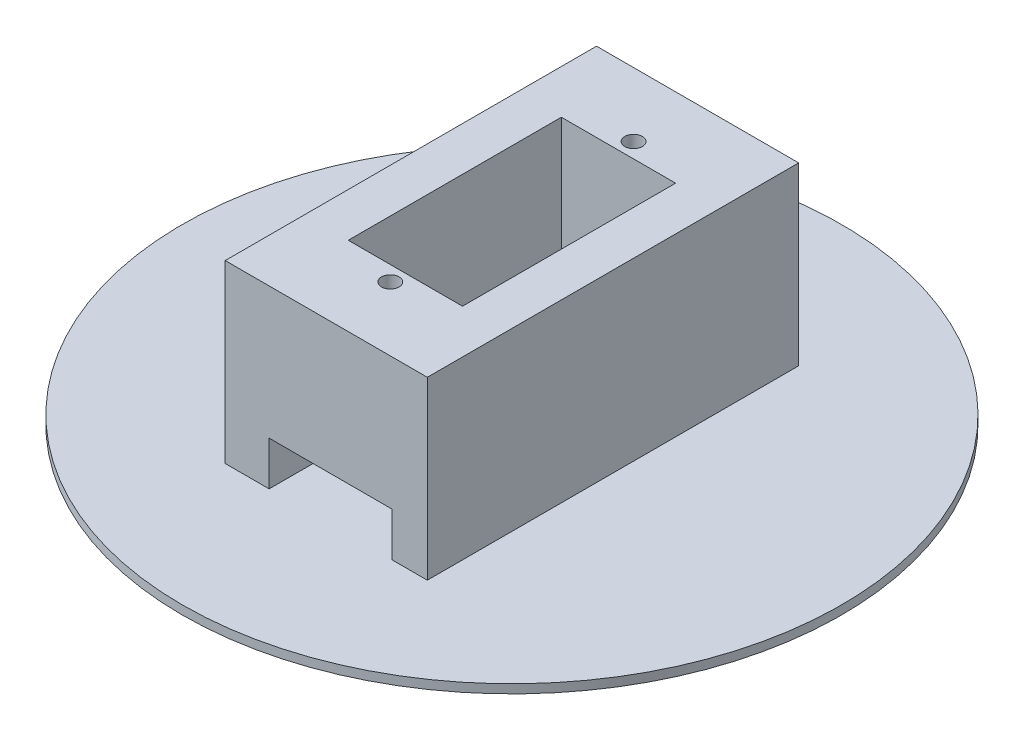
from build123d import *

# Parameters (mm, degrees)
SKETCH2_W           = 23
SKETCH2_H           = 42.25
SKETCH2_W_2         = 13
SKETCH2_H_2         = 24.25
SKETCH2_R           = 1
BOSS_EXTRUDE1_DEPTH = 20
SKETCH2_3_R         = 37.5
BOSS_EXTRUDE2_DEPTH = 1
SKETCH4_W           = 14
SKETCH4_H           = 5
CUT_EXTRUDE1_DEPTH  = 168


with BuildPart() as part:
    # Sketch2 → Boss-Extrude1 (new body)
    with BuildSketch(Plane(origin=(0, 0, 0), x_dir=(1, 0, 0), z_dir=(0, 1, 0))):
        with Locations((6.5, 16.125)):
            Rectangle(SKETCH2_W, SKETCH2_H)
        with Locations((6.5, 16.125)):
            Rectangle(SKETCH2_W_2, SKETCH2_H_2, mode=Mode.SUBTRACT)
        with Locations((6.5, 2.286)):
            Circle(SKETCH2_R, mode=Mode.SUBTRACT)
        with Locations((6.5, 29.964)):
            Circle(SKETCH2_R, mode=Mode.SUBTRACT)
    extrude(amount=BOSS_EXTRUDE1_DEPTH)

    # Sketch2<3> → Boss-Extrude2 (add)
    with BuildSketch(Plane(origin=(0, 0, 0), x_dir=(1, 0, 0), z_dir=(0, 1, 0))):
        with Locations((6.5, 16.125)):
            Circle(SKETCH2_3_R)
    extrude(amount=-BOSS_EXTRUDE2_DEPTH)

    # Sketch4 → Cut-Extrude1 (cut)
    with BuildSketch(Plane(origin=(0, 0, -37.25), x_dir=(-1, 0, 0), z_dir=(0, 0, -1))):
        with Locations((-7, 2.5)):
            Rectangle(SKETCH4_W, SKETCH4_H)
    extrude(amount=-CUT_EXTRUDE1_DEPTH, mode=Mode.SUBTRACT)


solid = part.part
